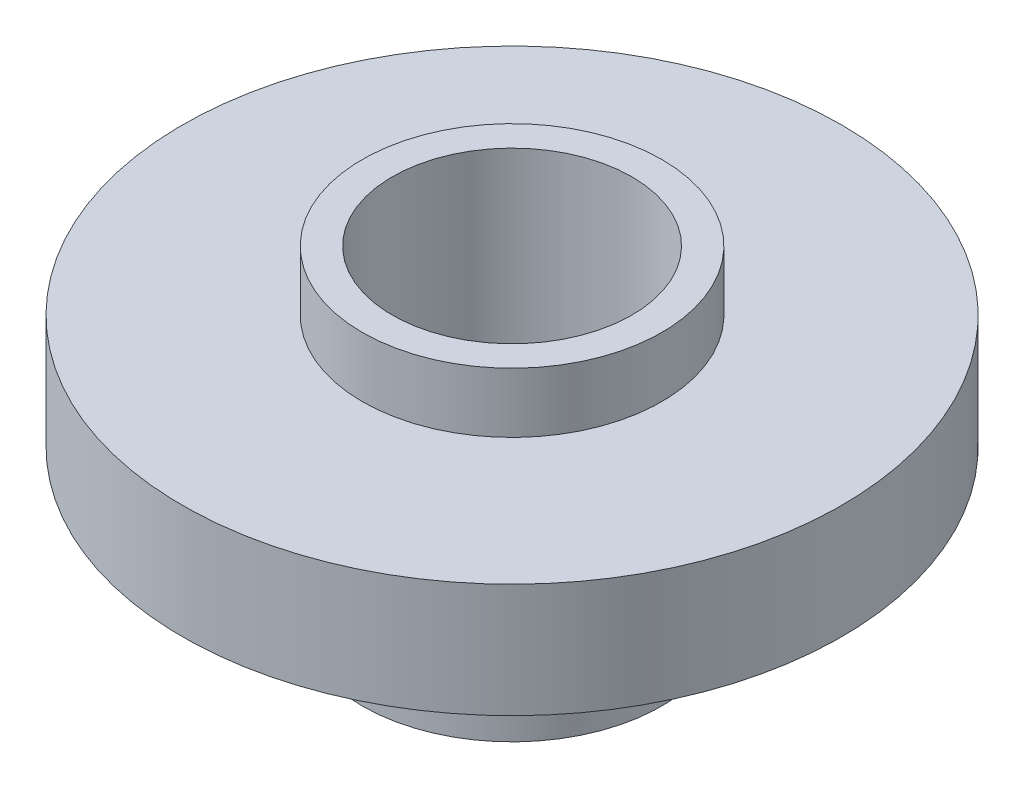
from build123d import *

# Parameters (mm, degrees)
SKETCH1_R           = 11
SKETCH1_R_2         = 4
BOSS_EXTRUDE1_DEPTH = 3.8
SKETCH2_R           = 5
SKETCH2_R_2         = 4
BOSS_EXTRUDE2_DEPTH = 10.8


with BuildPart() as part:
    # Sketch1 → Boss-Extrude1 (new body)
    with BuildSketch(Plane(origin=(0, 0, 0), x_dir=(1, 0, 0), z_dir=(0, 1, 0))):
        with Locations(Location((-3.732448162, -0.493369585, 0), (0, 0, 90))):
            Circle(SKETCH1_R)
        with Locations(Location((-3.732448162, -0.493369585, 0), (0, 0, 90))):
            Circle(SKETCH1_R_2, mode=Mode.SUBTRACT)
    extrude(amount=BOSS_EXTRUDE1_DEPTH)

    # Sketch2 → Boss-Extrude2 (add)
    with BuildSketch(Plane(origin=(0, -4.999999906, 0), x_dir=(-1, 0, 0), z_dir=(0, -1, 0))):
        with Locations(Location((3.732448162, -0.493369585, 0), (0, 0, 90))):
            Circle(SKETCH2_R)
        with Locations(Location((3.732448162, -0.493369585, 0), (0, 0, 90))):
            Circle(SKETCH2_R_2, mode=Mode.SUBTRACT)
    extrude(amount=-BOSS_EXTRUDE2_DEPTH)


solid = part.part
